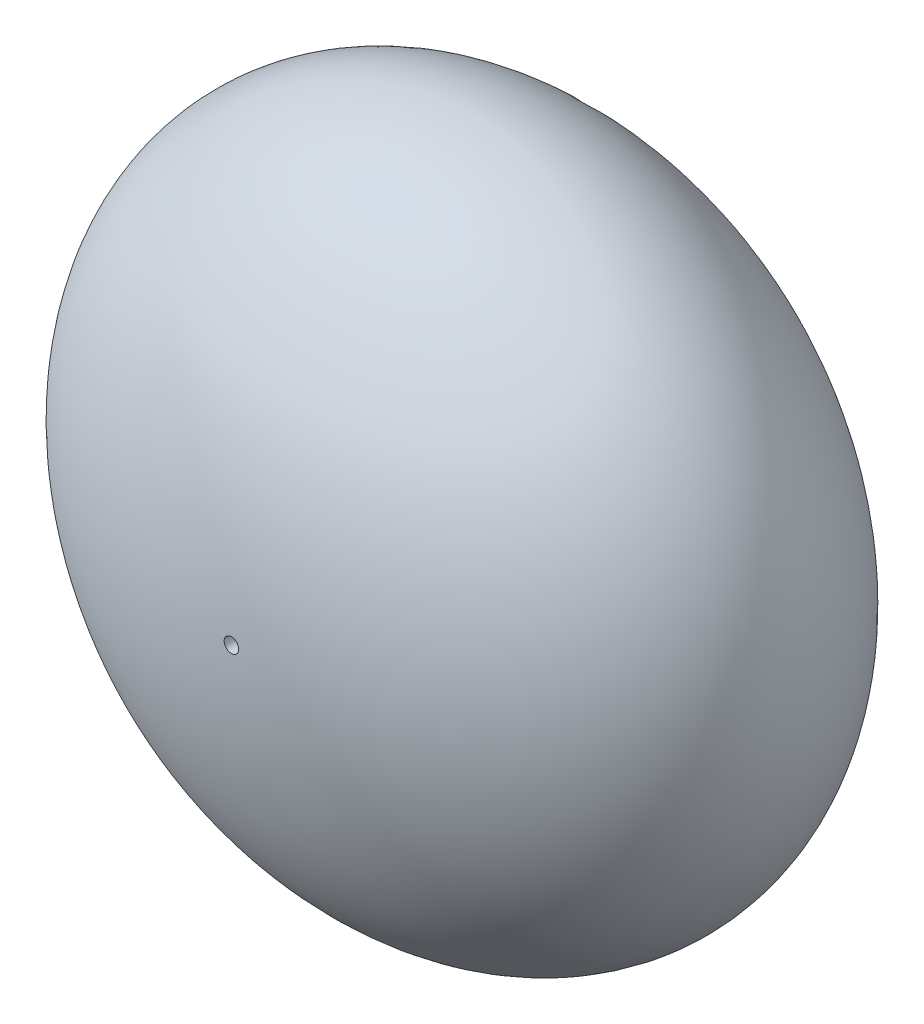
from build123d import *

# Parameters (mm, degrees)
SKETCH3_R               = 7
CUT_EXTRUDE1_DEPTH      = 13
CUT_EXTRUDE2_DEPTH      = 42.041138069
CUT_EXTRUDE2_DEPTH_BACK = 42.041138069
SKETCH4_R               = 0.55
CUT_EXTRUDE3_DEPTH      = 42.039500113
CUT_EXTRUDE3_DEPTH_BACK = 42.039500113
SKETCH5_R               = 1.3


with BuildPart() as part:
    # Sketch1 → Revolve4 (revolve)
    with BuildSketch(Plane(origin=(0, 0, 0), x_dir=(1, 0, 0), z_dir=(0, 1, 0))):
        with BuildLine():
            Line((0, 17.5), (0, -17.5))
            add(Edge.make_bspline(
                [(0, -17.5), (26.25, -17.5), (26.25, 0), (26.25, 17.5), (0, 17.5)],
                knots=[1.570796327, 1.570796327, 1.570796327, 3.141592654, 3.141592654, 4.71238898, 4.71238898, 4.71238898], degree=2, weights=[1, 0.707106781, 1, 0.707106781, 1]))
        make_face()
    revolve(axis=Axis((0, 0, -17.5), (0, 0, 1)))

    # Sketch3 → Cut-Extrude1 (cut)
    with BuildSketch(Plane.XY):
        Circle(SKETCH3_R)
    extrude(amount=CUT_EXTRUDE1_DEPTH, mode=Mode.SUBTRACT)

    # Sketch4 → Cut-Extrude2 (cut, two sides: drawn at the far end of the back side and taken through both)
    with BuildSketch(Plane.XY.offset(-CUT_EXTRUDE2_DEPTH_BACK)):
        Circle(SKETCH4_R)
    extrude(amount=CUT_EXTRUDE2_DEPTH + CUT_EXTRUDE2_DEPTH_BACK, mode=Mode.SUBTRACT)

    # Sketch5 → Cut-Extrude3 (cut, two sides: drawn at the far end of the back side and taken through both)
    with BuildSketch(Plane(origin=(0, 0, 0), x_dir=(1, 0, 0), z_dir=(0, 1, 0)).offset(-CUT_EXTRUDE3_DEPTH_BACK)):
        with Locations(Location((0, 10, 0), (0, 0, 270))):
            Circle(SKETCH5_R)
    extrude(amount=CUT_EXTRUDE3_DEPTH + CUT_EXTRUDE3_DEPTH_BACK, mode=Mode.SUBTRACT)


solid = part.part
